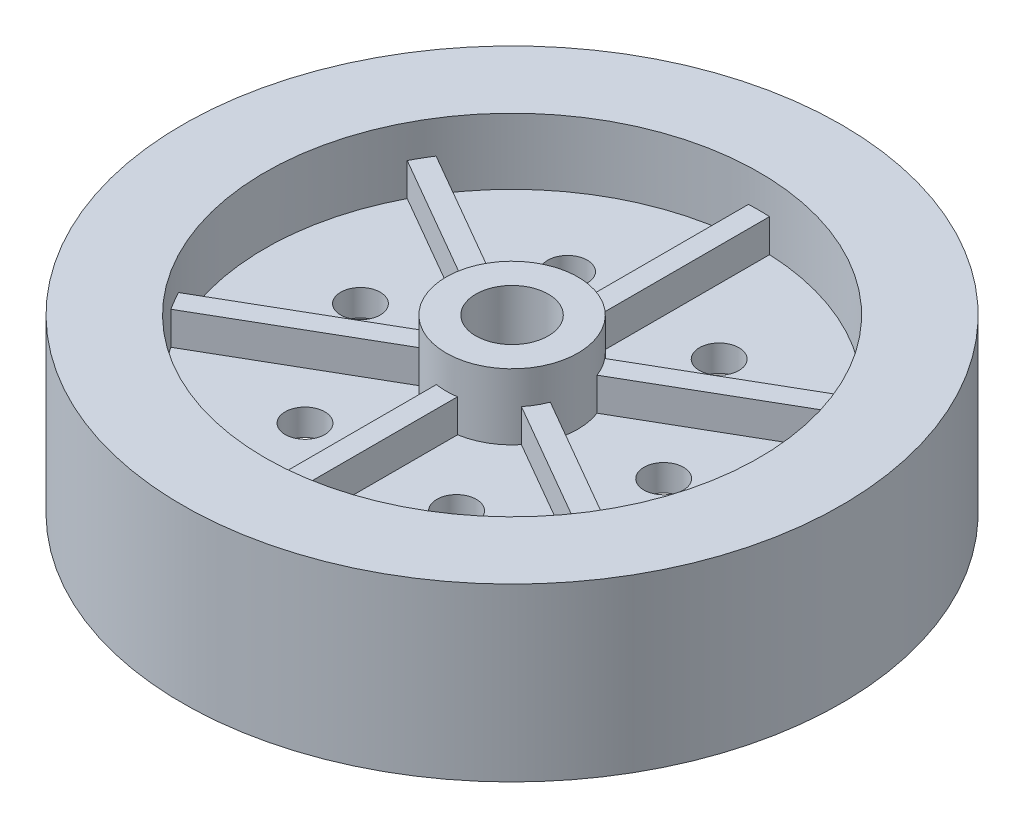
from build123d import *

# Parameters (mm, degrees)
SKETCH1_R           = 50
SKETCH1_R_2         = 37.5
BOSS_EXTRUDE1_DEPTH = 26
BOSS_EXTRUDE3_DEPTH = 9
BOSS_EXTRUDE4_START = -14
SKETCH9_R           = 10
SKETCH9_R_2         = 5.5
BOSS_EXTRUDE4_DEPTH = 14
SKETCH10_R          = 3
BOSS_EXTRUDE5_DEPTH = 4


with BuildPart() as part:
    # Sketch1 → Boss-Extrude1 (new body)
    with BuildSketch(Plane(origin=(0, 0, 0), x_dir=(1, 0, 0), z_dir=(0, 1, 0))):
        with Locations(Location((0, 0, 0), (0, 0, 90))):
            Circle(SKETCH1_R)
        with Locations(Location((0, 0, 0), (0, 0, 90))):
            Circle(SKETCH1_R_2, mode=Mode.SUBTRACT)
    extrude(amount=BOSS_EXTRUDE1_DEPTH)

    # Sketch3 → Boss-Extrude3 (add)
    with BuildSketch(Plane(origin=(0, 12, 0), x_dir=(1, 0, 0), z_dir=(0, 1, 0))):
        with BuildLine():
            Line((1.603162061, 37.465715947), (1.603162061, 9.870657091))
            ThreePointArc((1.603162061, 9.870657091), (0, 10), (-1.603162061, 9.870657091))
            Line((-1.603162061, 9.870657091), (-1.603162061, 37.465715947))
            ThreePointArc((-1.603162061, 37.465715947), (0, 37.5), (1.603162061, 37.465715947))
        make_face()
        with BuildLine():
            Line((31.64468075, 20.121237045), (7.746658762, 6.323707617))
            ThreePointArc((7.746658762, 6.323707617), (8.660254038, 5), (9.349820823, 3.546949474))
            Line((9.349820823, 3.546949474), (33.247842811, 17.344478902))
            ThreePointArc((33.247842811, 17.344478902), (32.475952642, 18.75), (31.64468075, 20.121237045))
        make_face()
        with BuildLine():
            Line((33.247842811, -17.344478902), (9.349820823, -3.546949474))
            ThreePointArc((9.349820823, -3.546949474), (8.660254038, -5), (7.746658762, -6.323707617))
            Line((7.746658762, -6.323707617), (31.64468075, -20.121237045))
            ThreePointArc((31.64468075, -20.121237045), (32.475952642, -18.75), (33.247842811, -17.344478902))
        make_face()
        with BuildLine():
            Line((1.603162061, -37.465715947), (1.603162061, -9.870657091))
            ThreePointArc((1.603162061, -9.870657091), (0, -10), (-1.603162061, -9.870657091))
            Line((-1.603162061, -9.870657091), (-1.603162061, -37.465715947))
            ThreePointArc((-1.603162061, -37.465715947), (0, -37.5), (1.603162061, -37.465715947))
        make_face()
        with BuildLine():
            Line((-31.64468075, -20.121237045), (-7.746658762, -6.323707617))
            ThreePointArc((-7.746658762, -6.323707617), (-8.660254038, -5), (-9.349820823, -3.546949474))
            Line((-9.349820823, -3.546949474), (-33.247842811, -17.344478902))
            ThreePointArc((-33.247842811, -17.344478902), (-32.475952642, -18.75), (-31.64468075, -20.121237045))
        make_face()
        with BuildLine():
            Line((-33.247842811, 17.344478902), (-9.349820823, 3.546949474))
            ThreePointArc((-9.349820823, 3.546949474), (-8.660254038, 5), (-7.746658762, 6.323707617))
            Line((-7.746658762, 6.323707617), (-31.64468075, 20.121237045))
            ThreePointArc((-31.64468075, 20.121237045), (-32.475952642, 18.75), (-33.247842811, 17.344478902))
        make_face()
    extrude(amount=BOSS_EXTRUDE3_DEPTH)

    # Sketch9 → Boss-Extrude4 (add)
    with BuildSketch(Plane(origin=(0, 26, 0), x_dir=(1, 0, 0), z_dir=(0, 1, 0)).offset(BOSS_EXTRUDE4_START)):
        with Locations(Location((0, 0, 0), (0, 0, 270))):
            Circle(SKETCH9_R)
        with Locations(Location((0, 0, 0), (0, 0, 270))):
            Circle(SKETCH9_R_2, mode=Mode.SUBTRACT)
    extrude(amount=BOSS_EXTRUDE4_DEPTH)

    # Sketch10 → Boss-Extrude5 (add)
    # profile 1 of 6: a face of its own
    with BuildSketch(Plane(origin=(0, 12, 0), x_dir=(1, 0, 0), z_dir=(0, 1, 0))):
        with BuildLine():
            Line((7.746658762, 6.323707617), (31.64468075, 20.121237045))
            ThreePointArc((31.64468075, 20.121237045), (18.75, 32.475952642), (1.603162061, 37.465715947))
            Line((1.603162061, 37.465715947), (1.603162061, 9.870657091))
            ThreePointArc((1.603162061, 9.870657091), (5, 8.660254038), (7.746658762, 6.323707617))
        make_face()
        with Locations(Location((11.5, 19.918584287, 0), (0, 0, 270))):
            Circle(SKETCH10_R, mode=Mode.SUBTRACT)
    # profile 2 of 6: a face of its own
    with BuildSketch(Plane(origin=(0, 12, 0), x_dir=(1, 0, 0), z_dir=(0, 1, 0))):
        with BuildLine():
            Line((33.247842811, 17.344478902), (9.349820823, 3.546949474))
            ThreePointArc((9.349820823, 3.546949474), (10, 0), (9.349820823, -3.546949474))
            Line((9.349820823, -3.546949474), (33.247842811, -17.344478902))
            ThreePointArc((33.247842811, -17.344478902), (37.5, 0), (33.247842811, 17.344478902))
        make_face()
        with Locations(Location((23, 0, 0), (0, 0, 270))):
            Circle(SKETCH10_R, mode=Mode.SUBTRACT)
    # profile 3 of 6: a face of its own
    with BuildSketch(Plane(origin=(0, 12, 0), x_dir=(1, 0, 0), z_dir=(0, 1, 0))):
        with BuildLine():
            Line((31.64468075, -20.121237045), (7.746658762, -6.323707617))
            ThreePointArc((7.746658762, -6.323707617), (5, -8.660254038), (1.603162061, -9.870657091))
            Line((1.603162061, -9.870657091), (1.603162061, -37.465715947))
            ThreePointArc((1.603162061, -37.465715947), (18.75, -32.475952642), (31.64468075, -20.121237045))
        make_face()
        with Locations(Location((11.5, -19.918584287, 0), (0, 0, 270))):
            Circle(SKETCH10_R, mode=Mode.SUBTRACT)
    # profile 4 of 6: a face of its own
    with BuildSketch(Plane(origin=(0, 12, 0), x_dir=(1, 0, 0), z_dir=(0, 1, 0))):
        with BuildLine():
            Line((-1.603162061, -37.465715947), (-1.603162061, -9.870657091))
            ThreePointArc((-1.603162061, -9.870657091), (-5, -8.660254038), (-7.746658762, -6.323707617))
            Line((-7.746658762, -6.323707617), (-31.64468075, -20.121237045))
            ThreePointArc((-31.64468075, -20.121237045), (-18.75, -32.475952642), (-1.603162061, -37.465715947))
        make_face()
        with Locations(Location((-11.5, -19.918584287, 0), (0, 0, 270))):
            Circle(SKETCH10_R, mode=Mode.SUBTRACT)
    # profile 5 of 6: a face of its own
    with BuildSketch(Plane(origin=(0, 12, 0), x_dir=(1, 0, 0), z_dir=(0, 1, 0))):
        with BuildLine():
            Line((-33.247842811, -17.344478902), (-9.349820823, -3.546949474))
            ThreePointArc((-9.349820823, -3.546949474), (-10, 0), (-9.349820823, 3.546949474))
            Line((-9.349820823, 3.546949474), (-33.247842811, 17.344478902))
            ThreePointArc((-33.247842811, 17.344478902), (-37.5, 0), (-33.247842811, -17.344478902))
        make_face()
        with Locations(Location((-23, 0, 0), (0, 0, 270))):
            Circle(SKETCH10_R, mode=Mode.SUBTRACT)
    # profile 6 of 6: a face of its own
    with BuildSketch(Plane(origin=(0, 12, 0), x_dir=(1, 0, 0), z_dir=(0, 1, 0))):
        with BuildLine():
            Line((-31.64468075, 20.121237045), (-7.746658762, 6.323707617))
            ThreePointArc((-7.746658762, 6.323707617), (-5, 8.660254038), (-1.603162061, 9.870657091))
            Line((-1.603162061, 9.870657091), (-1.603162061, 37.465715947))
            ThreePointArc((-1.603162061, 37.465715947), (-18.75, 32.475952642), (-31.64468075, 20.121237045))
        make_face()
        with Locations(Location((-11.5, 19.918584287, 0), (0, 0, 270))):
            Circle(SKETCH10_R, mode=Mode.SUBTRACT)
    extrude(amount=BOSS_EXTRUDE5_DEPTH)


solid = part.part
